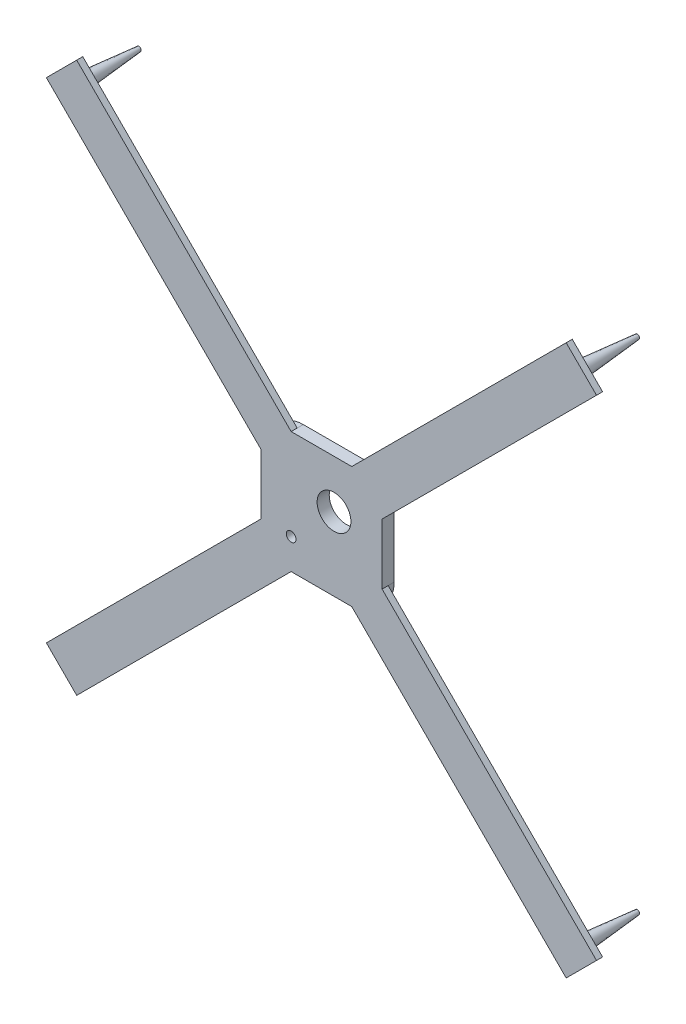
from build123d import *

# Parameters (mm, degrees)
SKETCH3_W                     = 50.8
SKETCH3_H                     = 50.8
BOSS_EXTRUDE2_DEPTH           = 5.08
SKETCH4_R                     = 2.032
CUT_EXTRUDE2_DEPTH            = 73.021430144
FILLET2_R                     = 12.7
BOSS_EXTRUDE3_DEPTH           = 2.54
SKETCH6_R                     = 3.175
BOSS_EXTRUDE4_DEPTH           = 25.4
BOSS_EXTRUDE4_DRAFT           = 5
BOSS_EXTRUDE4_PROFILE_2_DEPTH = 25.4
BOSS_EXTRUDE4_PROFILE_2_DRAFT = 5
BOSS_EXTRUDE4_PROFILE_3_DEPTH = 25.4
BOSS_EXTRUDE4_PROFILE_3_DRAFT = 5
BOSS_EXTRUDE4_PROFILE_4_DEPTH = 25.4
BOSS_EXTRUDE4_PROFILE_4_DRAFT = 5
SKETCH7_R                     = 7.081764105
CUT_EXTRUDE3_DEPTH            = 201.795428329


with BuildPart() as part:
    # Sketch3 → Boss-Extrude2 (new body)
    with BuildSketch(Plane.XY):
        with Locations((25.4, 25.4)):
            Rectangle(SKETCH3_W, SKETCH3_H)
    extrude(amount=BOSS_EXTRUDE2_DEPTH)

    # Sketch4 → Cut-Extrude2 (cut, through all)
    with BuildSketch(Plane.XY.offset(5.08)):
        with Locations((12.7, 12.7)):
            Circle(SKETCH4_R)
    extrude(amount=-CUT_EXTRUDE2_DEPTH, mode=Mode.SUBTRACT)

    # Fillet2
    fillet2_edges = [part.edges().sort_by_distance(p)[0] for p in [
        (0, 50.8, 2.54),
        (50.8, 50.8, 2.54),
        (50.8, 0, 2.54),
        (0, 0, 2.54),
    ]]
    fillet(fillet2_edges, radius=FILLET2_R)

    # Sketch5 → Boss-Extrude3 (add)
    with BuildSketch(Plane.XY.offset(5.08)):
        Polygon((127.902561211, -89.802561211), (38.1, 0), (50.8, 12.7), (140.602561211, -77.102561211), align=None)
        Polygon((-89.802561211, -77.102561211), (0, 12.7), (12.7, 0), (-77.102561211, -89.802561211), align=None)
        Polygon((0, 38.1), (-89.802561211, 127.902561211), (-77.102561211, 140.602561211), (12.7, 50.8), align=None)
        Polygon((50.8, 38.1), (140.602561211, 127.902561211), (127.902561211, 140.602561211), (38.1, 50.8), align=None)
    extrude(amount=-BOSS_EXTRUDE3_DEPTH)


with BuildPart() as boss_extrude4_tool:
    # Sketch6 → Boss-Extrude4 (with draft: the straight prism first)
    with BuildSketch(Plane(origin=(0, 0, 2.54), x_dir=(-1, 0, 0), z_dir=(0, 0, -1))):
        with Locations((-129.76243315, 129.76243315)):
            Circle(SKETCH6_R)
    extrude(amount=BOSS_EXTRUDE4_DEPTH)
    # Boss-Extrude4: the draft: its side faces are tilted about the plane it starts from
    boss_extrude4_sides = [boss_extrude4_tool.faces().sort_by_distance(p)[0] for p in [
        (132.93743315, 129.76243315, -10.16),
    ]]
    draft(boss_extrude4_sides, Plane(origin=(0, 0, 2.54), x_dir=(-1, 0, 0), z_dir=(0, 0, -1)), BOSS_EXTRUDE4_DRAFT)


with BuildPart() as part_1:
    add(part.part)

    # Boss-Extrude4: add boss_extrude4_tool
    add(boss_extrude4_tool.part)


with BuildPart() as boss_extrude4_profile_2_tool:
    # Sketch6 → Boss-Extrude4 profile 2 (with draft: the straight prism first)
    with BuildSketch(Plane(origin=(0, 0, 2.54), x_dir=(-1, 0, 0), z_dir=(0, 0, -1))):
        with Locations((78.96243315, 129.76243315)):
            Circle(SKETCH6_R)
    extrude(amount=BOSS_EXTRUDE4_PROFILE_2_DEPTH)
    # Boss-Extrude4 profile 2: the draft: its side faces are tilted about the plane it starts from
    boss_extrude4_profile_2_sides = [boss_extrude4_profile_2_tool.faces().sort_by_distance(p)[0] for p in [
        (-75.78743315, 129.76243315, -10.16),
    ]]
    draft(boss_extrude4_profile_2_sides, Plane(origin=(0, 0, 2.54), x_dir=(-1, 0, 0), z_dir=(0, 0, -1)), BOSS_EXTRUDE4_PROFILE_2_DRAFT)


with BuildPart() as part_2:
    add(part_1.part)

    # Boss-Extrude4 profile 2: add boss_extrude4_profile_2_tool
    add(boss_extrude4_profile_2_tool.part)


with BuildPart() as boss_extrude4_profile_3_tool:
    # Sketch6 → Boss-Extrude4 profile 3 (with draft: the straight prism first)
    with BuildSketch(Plane(origin=(0, 0, 2.54), x_dir=(-1, 0, 0), z_dir=(0, 0, -1))):
        with Locations((78.96243315, -78.96243315)):
            Circle(SKETCH6_R)
    extrude(amount=BOSS_EXTRUDE4_PROFILE_3_DEPTH)
    # Boss-Extrude4 profile 3: the draft: its side faces are tilted about the plane it starts from
    boss_extrude4_profile_3_sides = [boss_extrude4_profile_3_tool.faces().sort_by_distance(p)[0] for p in [
        (-75.78743315, -78.96243315, -10.16),
    ]]
    draft(boss_extrude4_profile_3_sides, Plane(origin=(0, 0, 2.54), x_dir=(-1, 0, 0), z_dir=(0, 0, -1)), BOSS_EXTRUDE4_PROFILE_3_DRAFT)


with BuildPart() as part_3:
    add(part_2.part)

    # Boss-Extrude4 profile 3: add boss_extrude4_profile_3_tool
    add(boss_extrude4_profile_3_tool.part)


with BuildPart() as boss_extrude4_profile_4_tool:
    # Sketch6 → Boss-Extrude4 profile 4 (with draft: the straight prism first)
    with BuildSketch(Plane(origin=(0, 0, 2.54), x_dir=(-1, 0, 0), z_dir=(0, 0, -1))):
        with Locations((-129.76243315, -78.96243315)):
            Circle(SKETCH6_R)
    extrude(amount=BOSS_EXTRUDE4_PROFILE_4_DEPTH)
    # Boss-Extrude4 profile 4: the draft: its side faces are tilted about the plane it starts from
    boss_extrude4_profile_4_sides = [boss_extrude4_profile_4_tool.faces().sort_by_distance(p)[0] for p in [
        (132.93743315, -78.96243315, -10.16),
    ]]
    draft(boss_extrude4_profile_4_sides, Plane(origin=(0, 0, 2.54), x_dir=(-1, 0, 0), z_dir=(0, 0, -1)), BOSS_EXTRUDE4_PROFILE_4_DRAFT)


with BuildPart() as part_4:
    add(part_3.part)

    # Boss-Extrude4 profile 4: add boss_extrude4_profile_4_tool
    add(boss_extrude4_profile_4_tool.part)

    # Sketch7 → Cut-Extrude3 (cut, through all)
    with BuildSketch(Plane.XY.offset(5.08)):
        with Locations((30.660512242, 30.660512242)):
            Circle(SKETCH7_R)
    extrude(amount=-CUT_EXTRUDE3_DEPTH, mode=Mode.SUBTRACT)


solid = part_4.part
